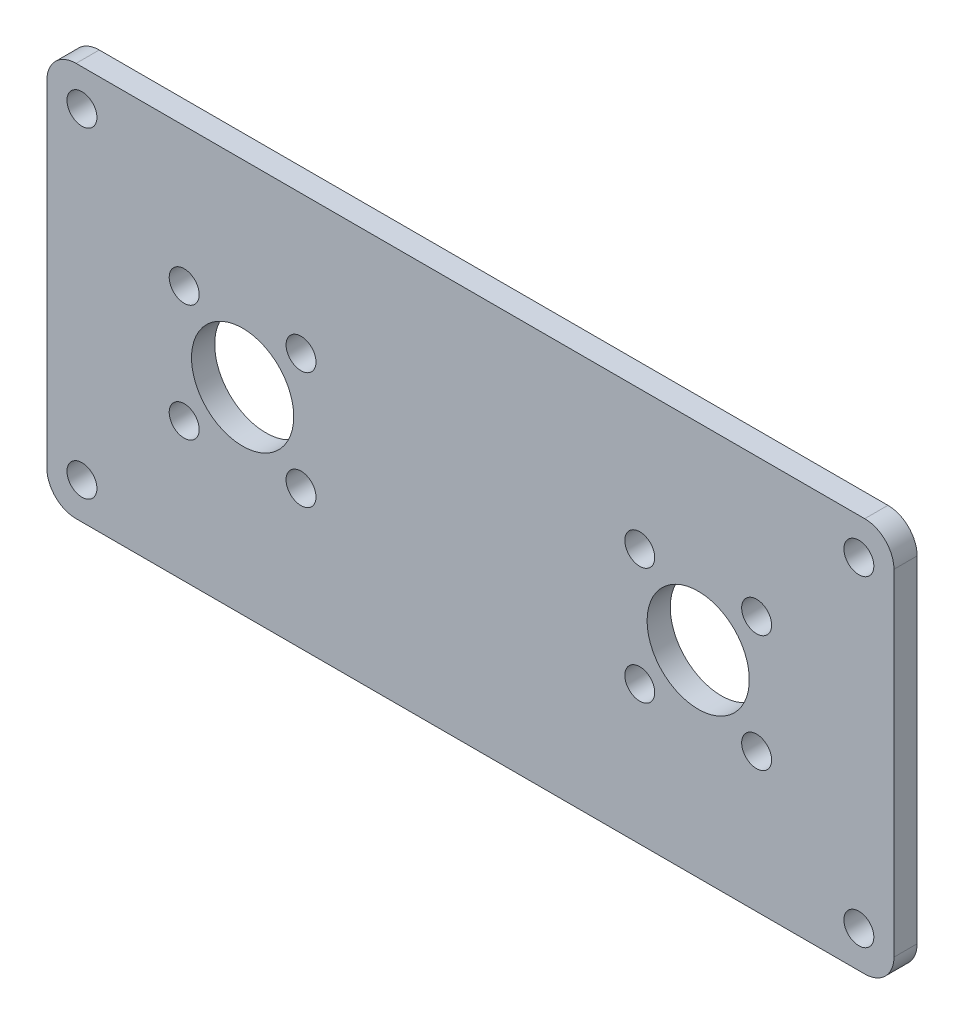
from build123d import *

# Parameters (mm, degrees)
SKETCH1_W           = 116
SKETCH1_H           = 54
SKETCH1_R           = 2.05
SKETCH1_R_2         = 7
BOSS_EXTRUDE1_DEPTH = 3.175
FILLET1_R           = 4


with BuildPart() as part:
    # Sketch1 → Boss-Extrude1 (new body)
    with BuildSketch(Plane.XY):
        Rectangle(SKETCH1_W, SKETCH1_H)
        with Locations((-53.195, 22)):
            Circle(SKETCH1_R, mode=Mode.SUBTRACT)
        with Locations((53.195, 22)):
            Circle(SKETCH1_R, mode=Mode.SUBTRACT)
        with Locations((53.195, -22)):
            Circle(SKETCH1_R, mode=Mode.SUBTRACT)
        with Locations((-53.195, -22)):
            Circle(SKETCH1_R, mode=Mode.SUBTRACT)
        with Locations((-39.195, 8)):
            Circle(SKETCH1_R, mode=Mode.SUBTRACT)
        with Locations((-23.195, 8)):
            Circle(SKETCH1_R, mode=Mode.SUBTRACT)
        with Locations((-23.195, -8)):
            Circle(SKETCH1_R, mode=Mode.SUBTRACT)
        with Locations((-39.195, -8)):
            Circle(SKETCH1_R, mode=Mode.SUBTRACT)
        with Locations((-31.195, 0)):
            Circle(SKETCH1_R_2, mode=Mode.SUBTRACT)
        with Locations(Location((39.195, -8, 0), (0, 0, 180))):
            Circle(SKETCH1_R, mode=Mode.SUBTRACT)
        with Locations(Location((39.195, 8, 0), (0, 0, 180))):
            Circle(SKETCH1_R, mode=Mode.SUBTRACT)
        with Locations(Location((23.195, 8, 0), (0, 0, 180))):
            Circle(SKETCH1_R, mode=Mode.SUBTRACT)
        with Locations(Location((31.195, 0, 0), (0, 0, 180))):
            Circle(SKETCH1_R_2, mode=Mode.SUBTRACT)
        with Locations(Location((23.195, -8, 0), (0, 0, 180))):
            Circle(SKETCH1_R, mode=Mode.SUBTRACT)
    extrude(amount=BOSS_EXTRUDE1_DEPTH)

    # Fillet1
    fillet1_edges = [part.edges().sort_by_distance(p)[0] for p in [
        (-58, 27, 1.5875),
        (58, 27, 1.5875),
        (58, -27, 1.5875),
        (-58, -27, 1.5875),
    ]]
    fillet(fillet1_edges, radius=FILLET1_R)


solid = part.part
